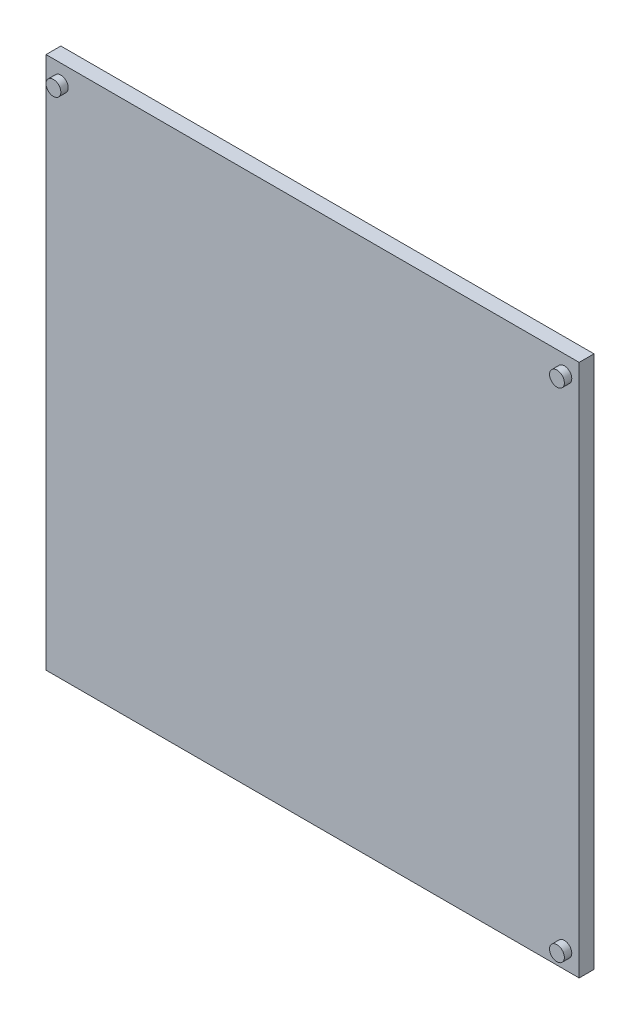
from build123d import *

# Parameters (mm, degrees)
SKETCH1_W           = 90
SKETCH1_H           = 90
BOSS_EXTRUDE1_DEPTH = 2.5
SKETCH2_R           = 1.25
BOSS_EXTRUDE2_DEPTH = 1.25


with BuildPart() as part:
    # Sketch1 → Boss-Extrude1 (new body)
    with BuildSketch(Plane.XY):
        Rectangle(SKETCH1_W, SKETCH1_H)
    extrude(amount=BOSS_EXTRUDE1_DEPTH)

    # Sketch2 → Boss-Extrude2 (add)
    with BuildSketch(Plane.XY.offset(2.5)):
        with Locations(Location((-42.5, 42, 0), (0, 0, 180))):
            Circle(SKETCH2_R)
        with Locations(Location((42.5, 42, 0), (0, 0, 180))):
            Circle(SKETCH2_R)
        with Locations(Location((42.5, -42, 0), (0, 0, 180))):
            Circle(SKETCH2_R)
    extrude(amount=BOSS_EXTRUDE2_DEPTH)


solid = part.part
